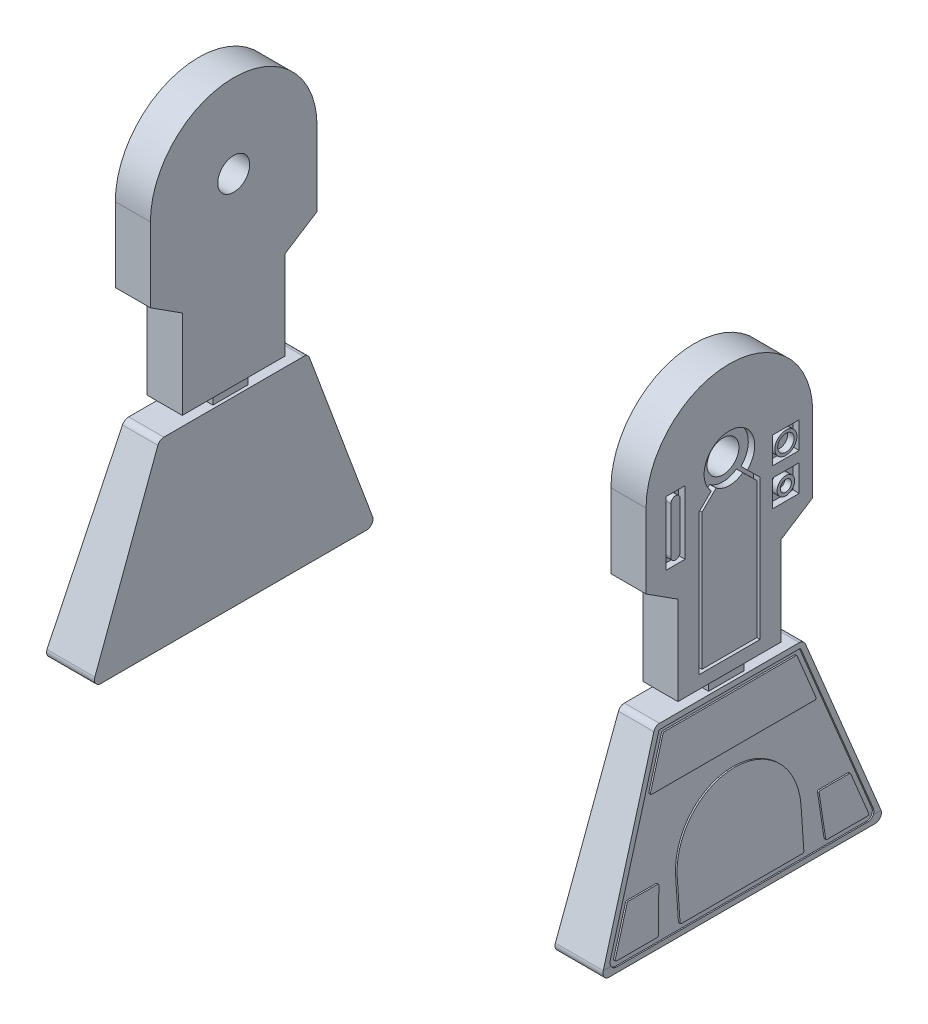
from build123d import *

# Parameters (mm, degrees)
BOSS_EXTRUDE1_DEPTH      = 19.05
CUT_EXTRUDE9_DEPTH       = 267.219287208
CUT_EXTRUDE9_DEPTH_BACK  = 267.219287208
CUT_EXTRUDE2_DEPTH       = 0.635
BOSS_EXTRUDE2_DEPTH      = 0.635
SKETCH5_W                = 11.43
SKETCH5_H                = 14
CUT_EXTRUDE3_DEPTH       = 1.27
SKETCH6_W                = 11.43
SKETCH6_H                = 14
BOSS_EXTRUDE3_DEPTH      = 5.08
BOSS_EXTRUDE5_START      = -5.08
BOSS_EXTRUDE5_DEPTH      = 13.97
SKETCH11_W               = 7.62
SKETCH11_H               = 25.4
SKETCH11_W_2             = 10.608857103
SKETCH11_H_2             = 10.608857103
CUT_EXTRUDE4_DEPTH       = 2.54
SKETCH12_R               = 6.35
SKETCH12_R_2             = 4.377389495
SKETCH12_R_3             = 3.263657612
SKETCH12_R_4             = 3.495151708
SKETCH12_R_5             = 2.209029983
BOSS_EXTRUDE6_DEPTH      = 2.54
CUT_EXTRUDE10_DEPTH      = 362.53544794
CUT_EXTRUDE10_DEPTH_BACK = 362.53544794
SKETCH23_R               = 6.35


with BuildPart() as part:
    # Sketch1 → Boss-Extrude1 (new body)
    with BuildSketch(Plane(origin=(172.100887829, 0, 0), x_dir=(0, 0, -1), z_dir=(1, 0, 0))):
        with BuildLine():
            Line((-91.836719048, 139.487127011), (-119.636098127, 139.487127011))
            ThreePointArc((-119.636098127, 139.487127011), (-121.084971286, 139.033359637), (-122.016166202, 137.834187301))
            Line((-122.016166202, 137.834187301), (-147.102855404, 70.524187301))
            ThreePointArc((-147.102855404, 70.524187301), (-146.809019955, 68.188253852), (-144.722787329, 67.097127011))
            Line((-144.722787329, 67.097127011), (-38.950650767, 67.097127011))
            ThreePointArc((-38.950650767, 67.097127011), (-36.864418142, 68.188253852), (-36.570582692, 70.524187301))
            Line((-36.570582692, 70.524187301), (-61.657271894, 137.834187301))
            ThreePointArc((-61.657271894, 137.834187301), (-62.58846681, 139.033359637), (-64.03733997, 139.487127011))
            Line((-64.03733997, 139.487127011), (-91.836719048, 139.487127011))
        make_face()
    extrude(amount=BOSS_EXTRUDE1_DEPTH)

    # Sketch21 → Cut-Extrude9 (cut, two sides: drawn at the far end of the back side and taken through both)
    with BuildSketch(Plane(origin=(0, 29.021384858, -1.503360615), x_dir=(1, 0, 0), z_dir=(0, 0, 1)).offset(-CUT_EXTRUDE9_DEPTH_BACK)):
        Polygon((191.150887829, 108.812802443), (191.150887829, 110.465742154), (186.070887829, 110.465742154), (191.150887829, 41.502802443), align=None)
    extrude(amount=CUT_EXTRUDE9_DEPTH + CUT_EXTRUDE9_DEPTH_BACK, mode=Mode.SUBTRACT)

    # Sketch3 → Cut-Extrude2 (cut)
    with BuildSketch(Plane(origin=(196.297585734, 0.655798064, 0), x_dir=(0, 0, -1), z_dir=(0.9972978910847858, 0.0734637083044337, 0))):
        with BuildLine():
            Line((-141.608375687, 68.671892754), (-41.877198425, 68.671892754))
            ThreePointArc((-41.877198425, 68.671892754), (-39.793786321, 69.75896674), (-39.493699493, 72.089692753))
            Line((-39.493699493, 72.089692753), (-63.561953327, 136.842100764))
            add(Edge.make_bspline(
                [(-63.561953327, 136.842100764), (-63.598143084, 136.93946445), (-63.663030965, 137.023825108), (-63.831069639, 137.142428429), (-63.933432917, 137.175482728), (-64.03733997, 137.175482728)],
                knots=[0, 0, 0, 0, 0.5, 0.5, 1, 1, 1, 1], degree=3))
            Line((-64.03733997, 137.175482728), (-119.636098127, 137.175482728))
            add(Edge.make_bspline(
                [(-119.636098127, 137.175482728), (-119.739982225, 137.175482728), (-119.841350083, 137.142911765), (-120.009881629, 137.024429305), (-120.075301614, 136.939446692), (-120.11148477, 136.842100764)],
                knots=[0, 0, 0, 0, 0.5, 0.5, 1, 1, 1, 1], degree=3))
            Line((-120.11148477, 136.842100764), (-144.179738603, 72.089692753))
            ThreePointArc((-144.179738603, 72.089692753), (-143.828600405, 69.677694304), (-141.608375687, 68.671892754))
        make_face()
    extrude(amount=-CUT_EXTRUDE2_DEPTH, mode=Mode.SUBTRACT)

    # Sketch4 → Boss-Extrude2 (add)
    with BuildSketch(Plane(origin=(195.662585734, 0.632441781, 0), x_dir=(0, 0, -1), z_dir=(0.9972978910847858, 0.07346370830443373, 0))):
        with BuildLine():
            Line((-118.036417617, 135.619117275), (-65.637020479, 135.619117275))
            ThreePointArc((-65.637020479, 135.619117275), (-65.347061339, 135.5282356), (-65.160850121, 135.288108207))
            Line((-65.160850121, 135.288108207), (-58.905763262, 118.459636176))
            ThreePointArc((-58.905763262, 118.459636176), (-58.964815295, 117.992686103), (-59.38193362, 117.774645244))
            Line((-59.38193362, 117.774645244), (-124.291504477, 117.774645244))
            ThreePointArc((-124.291504477, 117.774645244), (-124.708622801, 117.992686103), (-124.767674835, 118.459636176))
            Line((-124.767674835, 118.459636176), (-118.512587975, 135.288108207))
            ThreePointArc((-118.512587975, 135.288108207), (-118.326376758, 135.5282356), (-118.036417617, 135.619117275))
        make_face()
        with BuildLine():
            Line((-140.589132783, 70.67338181), (-125.643498778, 70.67338181))
            ThreePointArc((-125.643498778, 70.67338181), (-125.30042409, 70.806730294), (-125.137461566, 71.136768589))
            Line((-125.137461566, 71.136768589), (-123.723231673, 87.178043694))
            ThreePointArc((-123.723231673, 87.178043694), (-123.85461737, 87.565731603), (-124.229268885, 87.730656915))
            Line((-124.229268885, 87.730656915), (-135.836398422, 87.730656915))
            ThreePointArc((-135.836398422, 87.730656915), (-136.126357563, 87.639775239), (-136.31256878, 87.399647847))
            Line((-136.31256878, 87.399647847), (-142.275057171, 71.358372742))
            ThreePointArc((-142.275057171, 71.358372742), (-142.216005137, 70.891422669), (-141.798886813, 70.67338181))
            Line((-141.798886813, 70.67338181), (-140.589132783, 70.67338181))
        make_face()
        with BuildLine():
            Line((-41.874551284, 70.67338181), (-43.084305314, 70.67338181))
            Line((-43.084305314, 70.67338181), (-58.029939318, 70.67338181))
            ThreePointArc((-58.029939318, 70.67338181), (-58.373014007, 70.806730294), (-58.535976531, 71.136768589))
            Line((-58.535976531, 71.136768589), (-59.950206424, 87.178043694))
            ThreePointArc((-59.950206424, 87.178043694), (-59.818820727, 87.565731603), (-59.444169211, 87.730656915))
            Line((-59.444169211, 87.730656915), (-47.837039675, 87.730656915))
            ThreePointArc((-47.837039675, 87.730656915), (-47.547080534, 87.639775239), (-47.360869316, 87.399647847))
            Line((-47.360869316, 87.399647847), (-41.398380926, 71.358372742))
            ThreePointArc((-41.398380926, 71.358372742), (-41.457432959, 70.891422669), (-41.874551284, 70.67338181))
        make_face()
        with BuildLine():
            Line((-116.471727452, 71.18138181), (-116.471727452, 86.445159677))
            ThreePointArc((-116.471727452, 86.445159677), (-91.836719048, 111.080168081), (-67.201710644, 86.445159677))
            Line((-67.201710644, 86.445159677), (-67.201710644, 71.18138181))
            ThreePointArc((-67.201710644, 71.18138181), (-67.350500399, 70.822171565), (-67.709710644, 70.67338181))
            Line((-67.709710644, 70.67338181), (-115.963727452, 70.67338181))
            ThreePointArc((-115.963727452, 70.67338181), (-116.322937697, 70.822171565), (-116.471727452, 71.18138181))
        make_face()
    extrude(amount=BOSS_EXTRUDE2_DEPTH)

    # Sketch5 → Cut-Extrude3 (cut)
    with BuildSketch(Plane(origin=(0, 139.487127011, 0), x_dir=(1, 0, 0), z_dir=(0, 1, 0))):
        with Locations((179.085887829, -91.836719048)):
            Rectangle(SKETCH5_W, SKETCH5_H)
    extrude(amount=-CUT_EXTRUDE3_DEPTH, mode=Mode.SUBTRACT)

    # Sketch6 → Boss-Extrude3 (add)
    with BuildSketch(Plane(origin=(0, 138.217127011, 0), x_dir=(1, 0, 0), z_dir=(0, 1, 0))):
        with Locations((179.085887829, -91.836719048)):
            Rectangle(SKETCH6_W, SKETCH6_H)
    extrude(amount=BOSS_EXTRUDE3_DEPTH)

    # Sketch10 → Boss-Extrude5 (add)
    with BuildSketch(Plane(origin=(191.150887829, 0, 0), x_dir=(0, 0, -1), z_dir=(1, 0, 0)).offset(BOSS_EXTRUDE5_START)):
        with BuildLine():
            Line((-112.307828819, 143.297127011), (-112.307828819, 178.595032389))
            Line((-112.307828819, 178.595032389), (-124.992621128, 186.726309509))
            Line((-124.992621128, 186.726309509), (-124.992621128, 216.324158229))
            ThreePointArc((-124.992621128, 216.324158229), (-91.836719048, 249.480060308), (-58.680816969, 216.324158229))
            Line((-58.680816969, 216.324158229), (-58.680816969, 186.726309509))
            Line((-58.680816969, 186.726309509), (-71.365609277, 178.595032389))
            Line((-71.365609277, 178.595032389), (-71.365609277, 143.297127011))
            Line((-71.365609277, 143.297127011), (-112.307828819, 143.297127011))
        make_face()
    extrude(amount=-BOSS_EXTRUDE5_DEPTH)

    # Sketch11 → Cut-Extrude4 (cut)
    with BuildSketch(Plane(origin=(186.070887829, 0, 0), x_dir=(0, 0, -1), z_dir=(1, 0, 0))):
        with BuildLine():
            Line((-79.662466879, 148.377127011), (-104.010971218, 148.377127011))
            Line((-104.010971218, 148.377127011), (-104.010971218, 204.334349781))
            Line((-104.010971218, 204.334349781), (-99.010448011, 209.259113499))
            ThreePointArc((-99.010448011, 209.259113499), (-91.836719048, 226.392784961), (-84.662990085, 209.259113499))
            Line((-84.662990085, 209.259113499), (-79.662466879, 204.334349781))
            Line((-79.662466879, 204.334349781), (-79.662466879, 148.377127011))
        make_face()
        with Locations((-113.284031195, 203.624158229)):
            Rectangle(SKETCH11_W, SKETCH11_H)
        with Locations((-69.358910019, 211.019729678)):
            Rectangle(SKETCH11_W_2, SKETCH11_H_2)
        with Locations((-69.358910019, 196.22858678)):
            Rectangle(SKETCH11_W_2, SKETCH11_H_2)
    extrude(amount=-CUT_EXTRUDE4_DEPTH, mode=Mode.SUBTRACT)

    # Sketch12 → Boss-Extrude6 (add)
    # profile 1 of 5: a face of its own
    with BuildSketch(Plane(origin=(183.530887829, 0, 0), x_dir=(0, 0, -1), z_dir=(1, 0, 0))):
        with Locations(Location((-91.836719048, 216.324158229, 0), (0, 0, 90))):
            Circle(SKETCH12_R)
    # profile 2 of 5: a face of its own
    with BuildSketch(Plane(origin=(183.530887829, 0, 0), x_dir=(0, 0, -1), z_dir=(1, 0, 0))):
        with Locations(Location((-69.358910018, 211.019729677, 0), (0, 0, 90))):
            Circle(SKETCH12_R_2)
        with Locations((-69.358910018, 211.019729677)):
            Circle(SKETCH12_R_3, mode=Mode.SUBTRACT)
    # profile 3 of 5: a face of its own
    with BuildSketch(Plane(origin=(183.530887829, 0, 0), x_dir=(0, 0, -1), z_dir=(1, 0, 0))):
        with Locations(Location((-69.358910018, 196.22858678, 0), (0, 0, 90))):
            Circle(SKETCH12_R_4)
        with Locations((-69.358910018, 196.22858678)):
            Circle(SKETCH12_R_5, mode=Mode.SUBTRACT)
    # profile 4 of 5: a face of its own
    with BuildSketch(Plane(origin=(183.530887829, 0, 0), x_dir=(0, 0, -1), z_dir=(1, 0, 0))):
        with BuildLine():
            Line((-111.452731029, 212.869687186), (-111.452731029, 194.378629271))
            ThreePointArc((-111.452731029, 194.378629271), (-113.284031195, 192.547329106), (-115.11533136, 194.378629271))
            Line((-115.11533136, 194.378629271), (-115.11533136, 212.869687186))
            ThreePointArc((-115.11533136, 212.869687186), (-113.284031195, 214.700987352), (-111.452731029, 212.869687186))
        make_face()
    # profile 5 of 5: a face of its own
    with BuildSketch(Plane(origin=(183.530887829, 0, 0), x_dir=(0, 0, -1), z_dir=(1, 0, 0))):
        with BuildLine():
            Line((-102.740971218, 203.802611104), (-102.740971218, 149.647127011))
            Line((-102.740971218, 149.647127011), (-80.932466879, 149.647127011))
            Line((-80.932466879, 149.647127011), (-80.932466879, 203.802611104))
            Line((-80.932466879, 203.802611104), (-86.524636341, 209.310057454))
            ThreePointArc((-86.524636341, 209.310057454), (-91.836719048, 207.525531497), (-97.148801755, 209.310057454))
            Line((-97.148801755, 209.310057454), (-102.740971218, 203.802611104))
        make_face()
    extrude(amount=BOSS_EXTRUDE6_DEPTH)


with BuildPart() as body_2:
    # Mirror4: mirrored copy
    add(part.part.mirror(Plane(origin=(80.466018498, 0, 0), x_dir=(0, 0, 1), z_dir=(1, 0, 0))))


with BuildPart() as cut_extrude10_tool:
    # Sketch23 → Cut-Extrude10 (new, two sides: drawn at the far end of the back side and taken through both)
    with BuildSketch(Plane(origin=(186.070887829, 0, 0), x_dir=(0, 0, -1), z_dir=(1, 0, 0)).offset(-CUT_EXTRUDE10_DEPTH_BACK)):
        with Locations(Location((-91.836719048, 216.324158229, 0), (0, 0, 180))):
            Circle(SKETCH23_R)
    extrude(amount=CUT_EXTRUDE10_DEPTH + CUT_EXTRUDE10_DEPTH_BACK)


with BuildPart() as part_1:
    add(part.part)

    # Cut-Extrude10: cut by cut_extrude10_tool
    add(cut_extrude10_tool.part, mode=Mode.SUBTRACT)


with BuildPart() as body_2_1:
    add(body_2.part)

    # Cut-Extrude10: cut by cut_extrude10_tool
    add(cut_extrude10_tool.part, mode=Mode.SUBTRACT)


solid = Compound([part_1.part, body_2_1.part])
